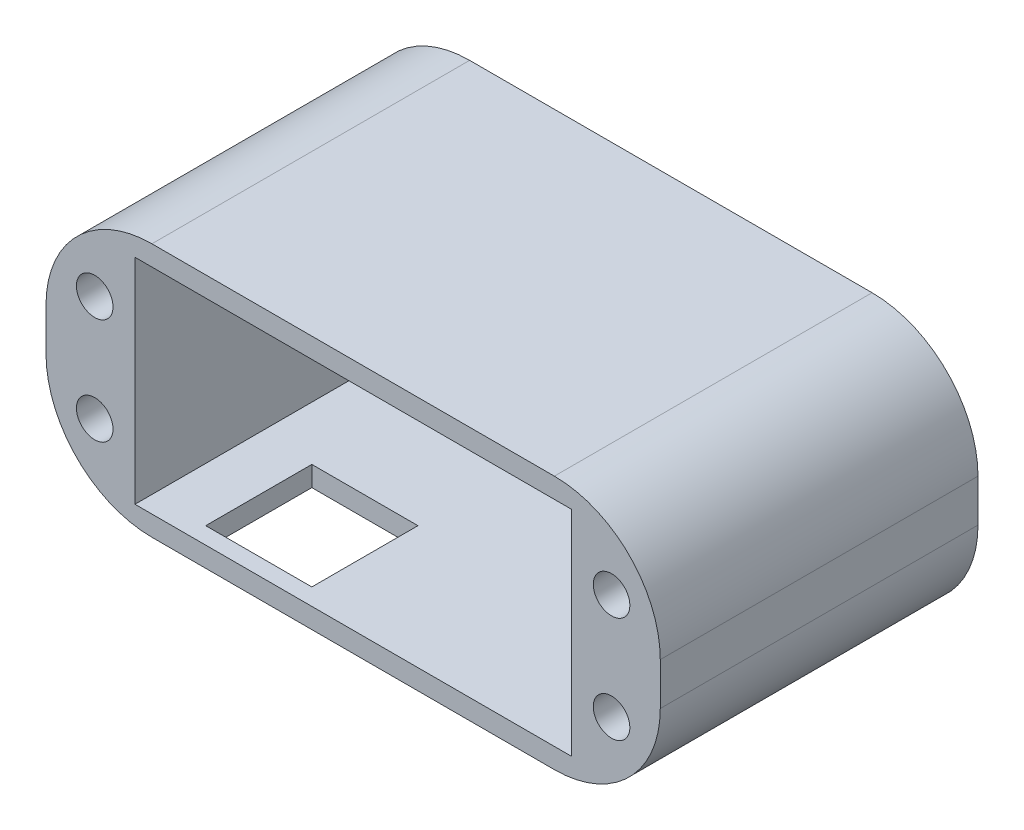
from build123d import *

# Parameters (mm, degrees)
SKETCH1_W                 = 58
SKETCH1_H                 = 24
BOSS_EXTRUDE1_DEPTH       = 30
F_8_32_TAPPED_HOLE2_D     = 3.4544
F_8_32_TAPPED_HOLE2_DEPTH = 12
F_8_32_TAPPED_HOLE2_TIP   = 1.037806461
SKETCH18_W                = 41.2
SKETCH18_H                = 20.2
CUT_EXTRUDE6_DEPTH        = 28
SKETCH22_R                = 1.505
CUT_EXTRUDE9_DEPTH        = 2
SKETCH24_W                = 10.02
SKETCH24_H                = 10.02
CUT_EXTRUDE11_DEPTH       = 2
FILLET1_R                 = 10
FILLET2_R                 = 10
FILLET3_R                 = 10
FILLET4_R                 = 10


with BuildPart() as part:
    # Sketch1 → Boss-Extrude1 (new body)
    with BuildSketch(Plane.XY):
        Rectangle(SKETCH1_W, SKETCH1_H)
    extrude(amount=-BOSS_EXTRUDE1_DEPTH)

    # #8-32 Tapped Hole2
    with Locations(Plane(origin=(24.4, -5, 0), x_dir=(1, 0, 0), z_dir=(0, 0, 1))):
        with Locations((0, 0), (0, 10), (-48.8, 0), (-48.8, 10)):
            Hole(F_8_32_TAPPED_HOLE2_D / 2, depth=F_8_32_TAPPED_HOLE2_DEPTH)
            with Locations((0, 0, -(F_8_32_TAPPED_HOLE2_DEPTH + F_8_32_TAPPED_HOLE2_TIP / 2))):  # 118° drill point
                Cone(0, F_8_32_TAPPED_HOLE2_D / 2, F_8_32_TAPPED_HOLE2_TIP, mode=Mode.SUBTRACT)

    # Sketch18 → Cut-Extrude6 (cut)
    with BuildSketch(Plane.XY):
        Rectangle(SKETCH18_W, SKETCH18_H)
    extrude(amount=-CUT_EXTRUDE6_DEPTH, mode=Mode.SUBTRACT)

    # Sketch22 → Cut-Extrude9 (cut)
    with BuildSketch(Plane(origin=(0, 0, -30), x_dir=(-1, 0, 0), z_dir=(0, 0, -1))):
        with Locations((10.5, 0)):
            Circle(SKETCH22_R)
    extrude(amount=-CUT_EXTRUDE9_DEPTH, mode=Mode.SUBTRACT)

    # Sketch24 → Cut-Extrude11 (cut)
    with BuildSketch(Plane(origin=(0, -10.1, 0), x_dir=(1, 0, 0), z_dir=(0, 1, 0))):
        with Locations((-10.5, 6.6)):
            Rectangle(SKETCH24_W, SKETCH24_H)
    extrude(amount=-CUT_EXTRUDE11_DEPTH, mode=Mode.SUBTRACT)

    # Fillet1
    fillet1_edges = [part.edges().sort_by_distance(p)[0] for p in [
        (-29, 12, -15),
    ]]
    fillet(fillet1_edges, radius=FILLET1_R)

    # Fillet2
    fillet2_edges = [part.edges().sort_by_distance(p)[0] for p in [
        (29, 12, -15),
    ]]
    fillet(fillet2_edges, radius=FILLET2_R)

    # Fillet3
    fillet3_edges = [part.edges().sort_by_distance(p)[0] for p in [
        (29, -12, -15),
    ]]
    fillet(fillet3_edges, radius=FILLET3_R)

    # Fillet4
    fillet4_edges = [part.edges().sort_by_distance(p)[0] for p in [
        (-29, -12, -15),
    ]]
    fillet(fillet4_edges, radius=FILLET4_R)


solid = part.part
